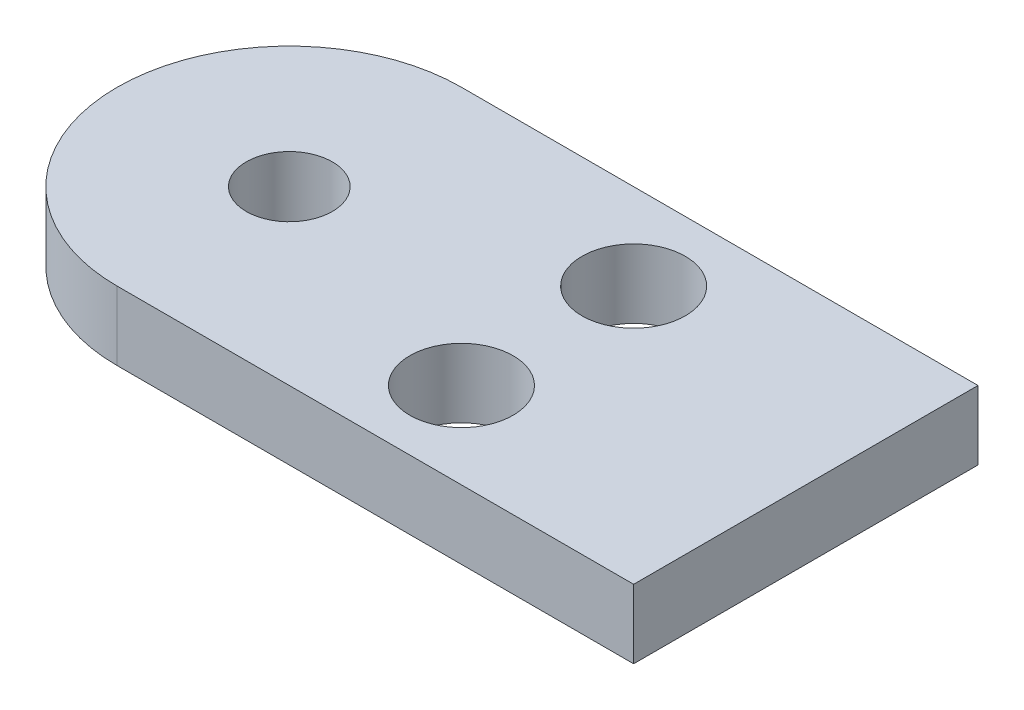
from build123d import *

# Parameters (mm, degrees)
SKETCH1_R           = 2.5
BOSS_EXTRUDE1_DEPTH = 4
CUT_EXTRUDE2_DEPTH  = 0.2
SKETCH6_R           = 0.5
CUT_EXTRUDE3_DEPTH  = 1.5
SKETCH7_R           = 3
CUT_EXTRUDE4_DEPTH  = 32.874754901


with BuildPart() as part:
    # Sketch1 → Boss-Extrude1 (new body)
    with BuildSketch(Plane(origin=(0, 0, 0), x_dir=(1, 0, 0), z_dir=(0, 1, 0))):
        with BuildLine():
            Line((10, 10), (30, 10))
            Line((30, 10), (30, -10))
            Line((30, -10), (10, -10))
            Line((10, -10), (0, -10))
            ThreePointArc((0, -10), (-10, 0), (0, 10))
            Line((0, 10), (10, 10))
        make_face()
        with Locations(Location((0, 0, 0), (0, 0, 270))):
            Circle(SKETCH1_R, mode=Mode.SUBTRACT)
    extrude(amount=BOSS_EXTRUDE1_DEPTH)

    # Sketch5 → Cut-Extrude2 (cut)
    with BuildSketch(Plane.XZ):
        Polygon((-5.5, -2.5), (-5.5, 2.5), (-2.5, 5.5), (6.5, 5.5), (6.5, -5.5), (-2.5, -5.5), align=None)
    extrude(amount=-CUT_EXTRUDE2_DEPTH, mode=Mode.SUBTRACT)

    # Sketch6 → Cut-Extrude3 (cut)
    with BuildSketch(Plane.XZ):
        with Locations(Location((5.5, 4.25, 0), (0, 0, 270))):
            Circle(SKETCH6_R)
        with Locations(Location((5.5, -4.25, 0), (0, 0, 270))):
            Circle(SKETCH6_R)
    extrude(amount=-CUT_EXTRUDE3_DEPTH, mode=Mode.SUBTRACT)

    # Sketch7 → Cut-Extrude4 (cut, through all)
    with BuildSketch(Plane(origin=(0, 4, 0), x_dir=(1, 0, 0), z_dir=(0, 1, 0))):
        with Locations(Location((15, 5, 0), (0, 0, 270))):
            Circle(SKETCH7_R)
        with Locations(Location((15, -5, 0), (0, 0, 270))):
            Circle(SKETCH7_R)
    extrude(amount=-CUT_EXTRUDE4_DEPTH, mode=Mode.SUBTRACT)


solid = part.part
